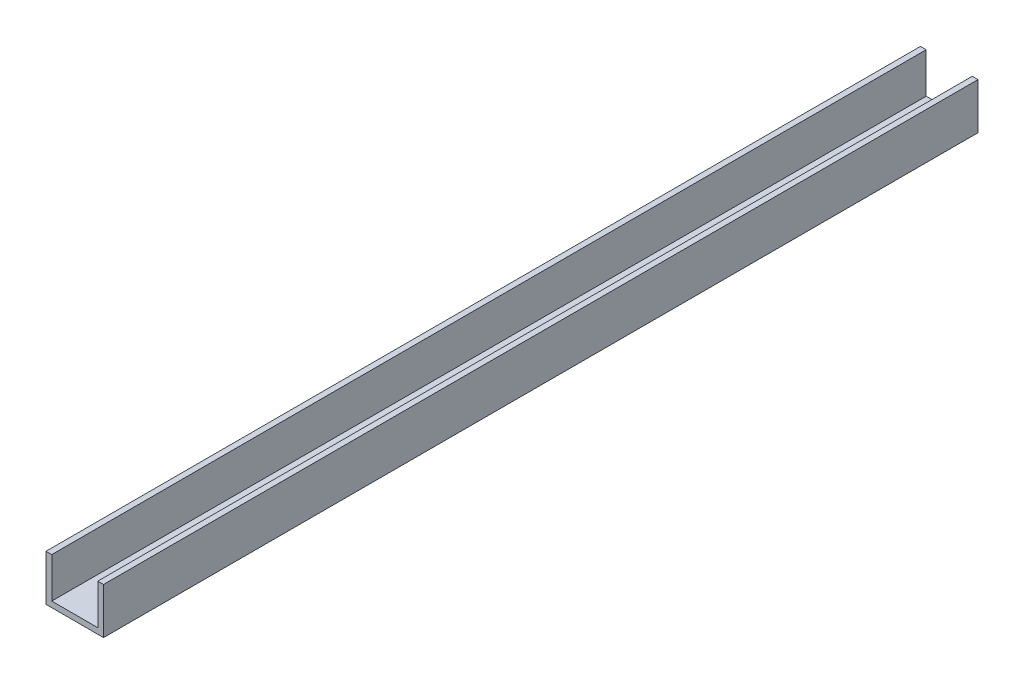
from build123d import *

# Parameters (mm, degrees)
BOSS_EXTRUDE1_DEPTH = 241.3


with BuildPart() as part:
    # Sketch1 → Boss-Extrude1 (new body)
    with BuildSketch(Plane.XY):
        Polygon((0, 0), (7.9375, 0), (7.9375, 12.7), (6.35, 12.7), (6.35, 1.5875), (-6.35, 1.5875), (-6.35, 12.7), (-7.9375, 12.7), (-7.9375, 0), align=None)
    extrude(amount=BOSS_EXTRUDE1_DEPTH)


solid = part.part
